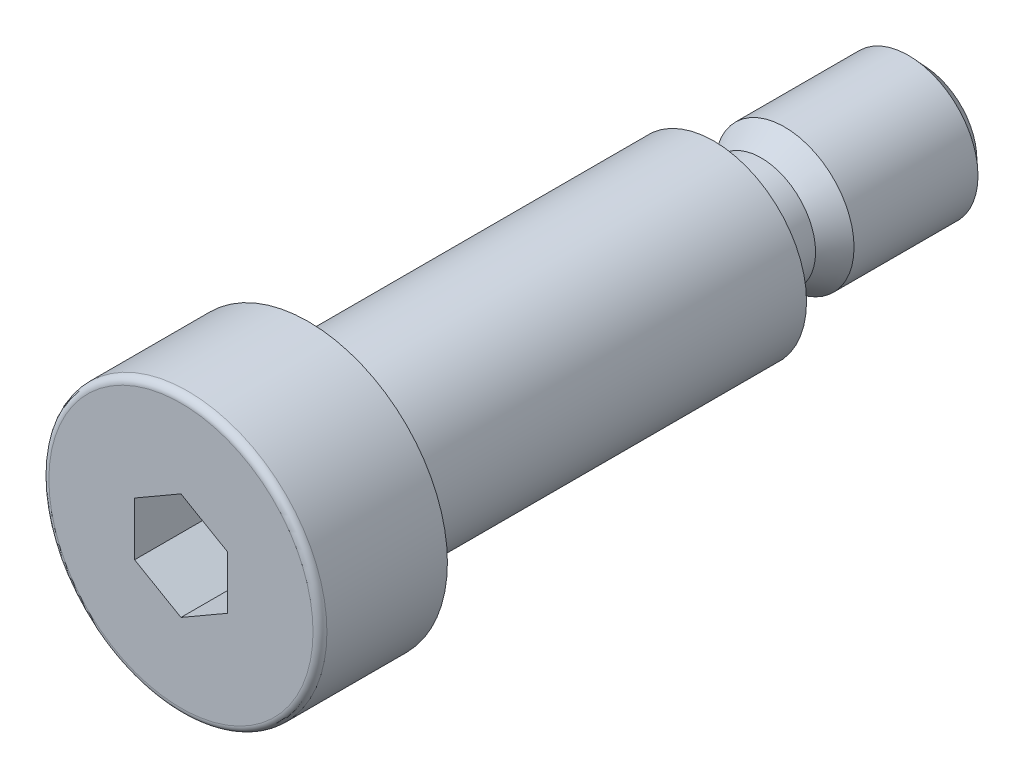
from build123d import *

# Parameters (mm, degrees)
SZKIC1_W                   = 4.7
SZKIC1_H                   = 4.08
WYTNIJ_WYCI_GNI_CIE1_DEPTH = 6.6
ZAOKR_GLENIE1_R            = 0.6


with BuildPart() as part:
    # Szkic1 → Obrót1 (revolve)
    with BuildSketch(Plane(origin=(0, 0, 0), x_dir=(1, 0, 0), z_dir=(0, 1, 0)), mode=Mode.PRIVATE) as obr_t1_sk:
        Polygon((0, -28.5), (0, -17.5), (-8, -17.5), (-12, -17.5), (-12, -28.5), align=None)
        Polygon((0, -17.5), (0, 17.5), (-4.7, 17.5), (-8, 17.5), (-8, -17.5), align=None)
        with Locations((-2.35, 19.54)):
            Rectangle(SZKIC1_W, SZKIC1_H)
        Polygon((-4.7, 21.58), (0, 21.58), (0, 35.5), (-4.7, 35.5), (-6, 34.3), (-6, 23.6), align=None)
    revolve(obr_t1_sk.sketch.rotate(Axis((0, 0, 28.5), (0, 0, -1)), 180), axis=Axis((0, 0, 28.5), (0, 0, -1)))

    # Szkic2 → Wytnij-wyciągnięcie1 (cut)
    with BuildSketch(Plane.XY.offset(28.5)):
        Polygon((4, 2.309401077), (0, 4.618802154), (-4, 2.309401077), (-4, -2.309401077), (0, -4.618802154), (4, -2.309401077), align=None)
    extrude(amount=-WYTNIJ_WYCI_GNI_CIE1_DEPTH, mode=Mode.SUBTRACT)

    # Zaokrąglenie1
    zaokr_glenie1_edges = [part.edges().sort_by_distance(p)[0] for p in [
        (-12, 0, 28.5),
    ]]
    fillet(zaokr_glenie1_edges, radius=ZAOKR_GLENIE1_R)


solid = part.part
